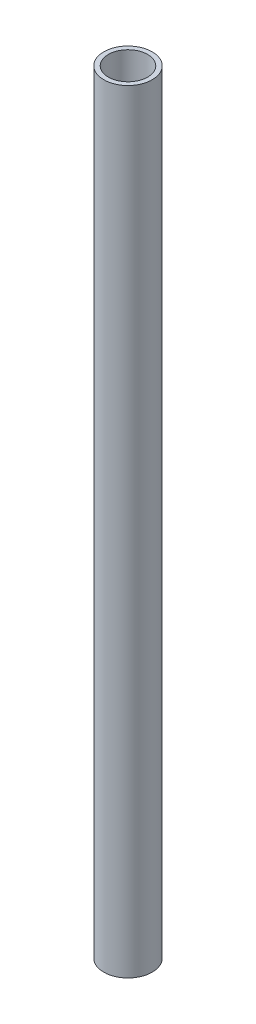
from build123d import *

# Parameters (mm, degrees)
SKETCH_1_R      = 10.65
SKETCH_1_R_2    = 8.65
EXTRUDE_1_DEPTH = 340


with BuildPart() as part:
    # Эскиз1 → Бобышка-Вытянуть1 (new body)
    with BuildSketch(Plane(origin=(0, 0, 0), x_dir=(1, 0, 0), z_dir=(0, 1, 0))):
        with Locations(Location((0, -1.5, 0), (0, 0, 270))):
            Circle(SKETCH_1_R)
        with Locations(Location((0, -1.5, 0), (0, 0, 270))):
            Circle(SKETCH_1_R_2, mode=Mode.SUBTRACT)
    extrude(amount=EXTRUDE_1_DEPTH)


solid = part.part
